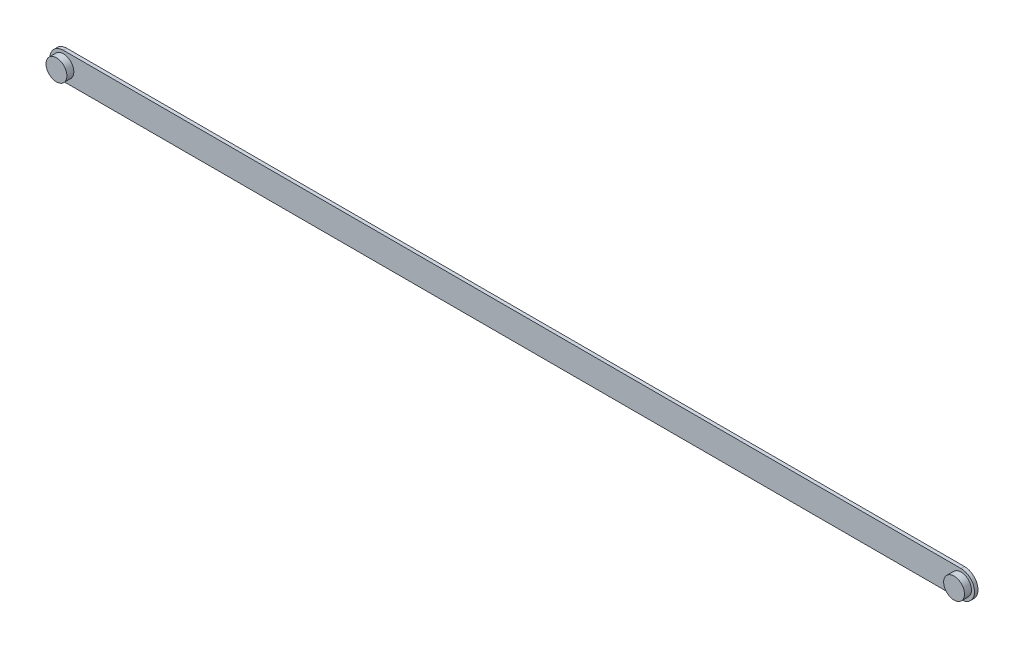
from build123d import *

# Parameters (mm, degrees)
EXTRUDE_1_DEPTH = 1
SKETCH_2_R      = 3
EXTRUDE_2_DEPTH = 2
SKETCH_3_R      = 3
EXTRUDE_3_DEPTH = 2


with BuildPart() as part:
    # 草图1 → 凸台-拉伸1 (new body)
    with BuildSketch(Plane.XY):
        with BuildLine():
            Line((0, -3.874788925), (-258.053276248, -3.874788925))
            ThreePointArc((-258.053276248, -3.874788925), (-261.928065173, 0), (-258.053276248, 3.874788925))
            Line((-258.053276248, 3.874788925), (0, 3.874788925))
            ThreePointArc((0, 3.874788925), (3.874788925, 0), (0, -3.874788925))
        make_face()
    extrude(amount=EXTRUDE_1_DEPTH)

    # 草图2 → 凸台-拉伸2 (add)
    with BuildSketch(Plane.XY.offset(1)):
        Circle(SKETCH_2_R)
    extrude(amount=EXTRUDE_2_DEPTH)

    # 草图3 → 凸台-拉伸3 (add)
    with BuildSketch(Plane.XY.offset(1)):
        with Locations((-258.053276248, 0)):
            Circle(SKETCH_3_R)
    extrude(amount=EXTRUDE_3_DEPTH)


solid = part.part
